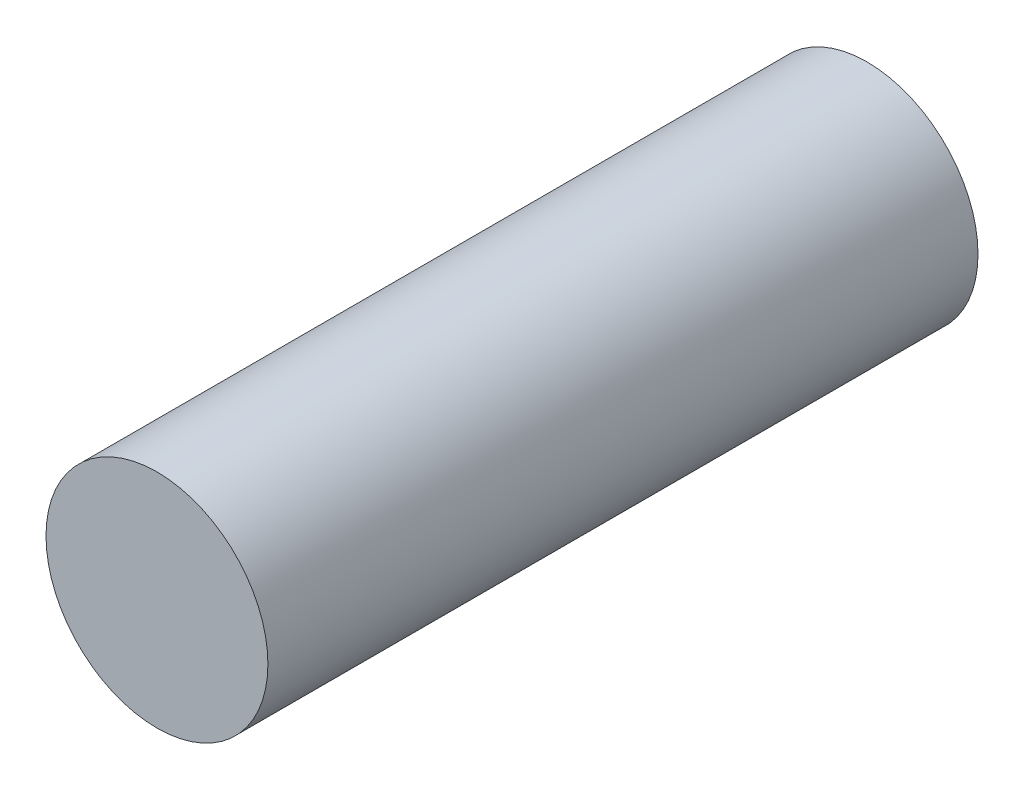
from build123d import *

# Parameters (mm, degrees)
SKETCH1_R           = 2.5
BOSS_EXTRUDE1_DEPTH = 16


with BuildPart() as part:
    # Sketch1 → Boss-Extrude1 (new body)
    with BuildSketch(Plane.XY):
        Circle(SKETCH1_R)
    extrude(amount=BOSS_EXTRUDE1_DEPTH)


solid = part.part
